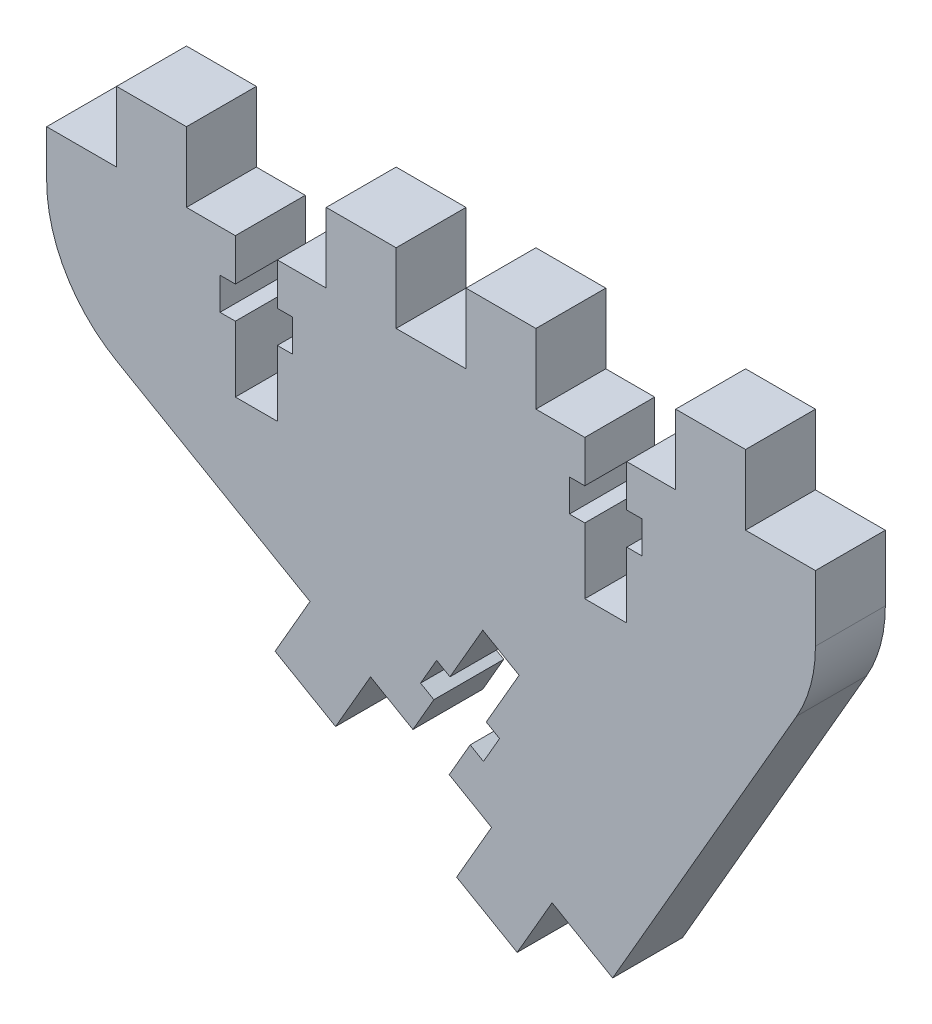
from build123d import *

# Parameters (mm, degrees)
BOSS_EXTRU_1_DEPTH = 5
CONG_1_R           = 10


with BuildPart() as part:
    # Esquisse1 → Boss.-Extru.1 (new body)
    with BuildSketch(Plane.XY):
        Polygon((-12.990381057, 7.5), (-8.660254038, 5), (-11.160254038, 0.669872981), (-6.830127019, -1.830127019), (-4.330127019, 2.5), (-1.299038106, 0.75), (0.200961894, 3.348076211), (-0.75166605, 3.898076211), (0.39833395, 5.88993464), (1.350961894, 5.33993464), (3.700961894, 9.410254038), (6.299038106, 7.910254038), (3.949038106, 3.83993464), (4.90166605, 3.28993464), (3.75166605, 1.298076211), (2.799038106, 1.848076211), (1.299038106, -0.75), (4.330127019, -2.5), (1.830127019, -6.830127019), (6.160254038, -9.330127019), (8.660254038, -5), (12.990381057, -7.5), (27.5, 17.631397208), (27.5, 25), (22.5, 25), (22.5, 30), (17.5, 30), (17.5, 25), (14, 25), (14, 22), (15.1, 22), (15.1, 19.7), (14, 19.7), (14, 15), (11, 15), (11, 19.7), (9.9, 19.7), (9.9, 22), (11, 22), (11, 25), (7.5, 25), (7.5, 30), (2.5, 30), (2.5, 25), (-2.5, 25), (-2.5, 30), (-7.5, 30), (-7.5, 25), (-11, 25), (-11, 22), (-9.9, 22), (-9.9, 19.7), (-11, 19.7), (-11, 15), (-14, 15), (-14, 19.7), (-15.1, 19.7), (-15.1, 22), (-14, 22), (-14, 25), (-17.5, 25), (-17.5, 30), (-22.5, 30), (-22.5, 25), (-27.5, 25), (-27.5, 15.877132403), align=None)
    extrude(amount=BOSS_EXTRU_1_DEPTH)

    # Congé1
    cong_1_edges = [part.edges().sort_by_distance(p)[0] for p in [
        (27.5, 17.631397208, 2.5),
        (-27.5, 15.877132403, 2.5),
    ]]
    fillet(cong_1_edges, radius=CONG_1_R)


solid = part.part
